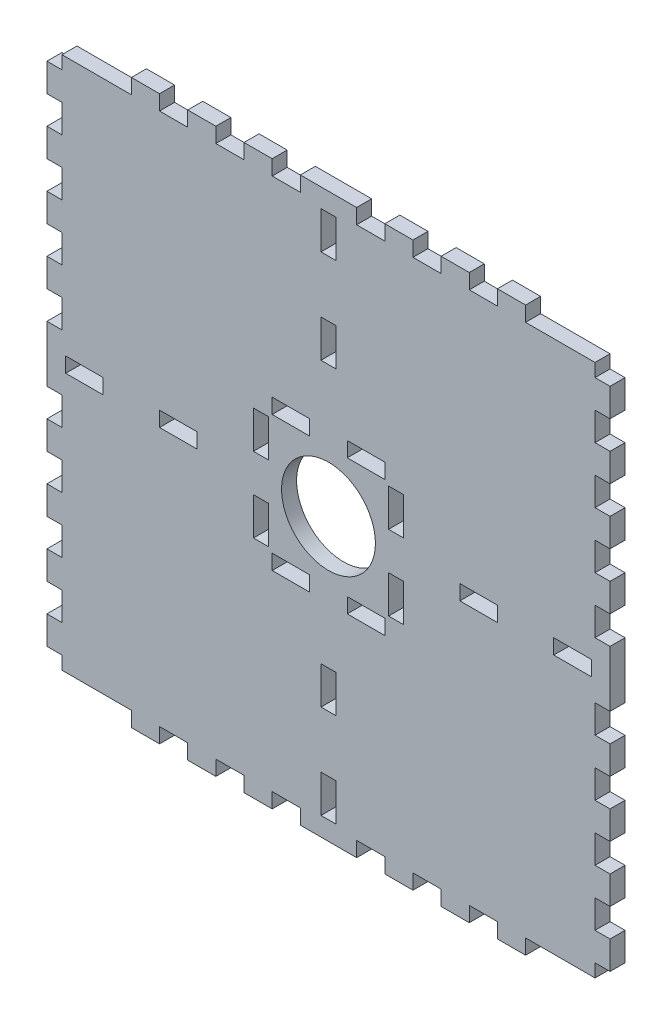
from build123d import *

# Parameters (mm, degrees)
ESQUISSE1_W                  = 300
ESQUISSE1_H                  = 300
BOSS_EXTRU_1_DEPTH           = 8
ESQUISSE3_W                  = 8
ESQUISSE3_H                  = 15
ENL_V_MAT_EXTRU_4_DEPTH      = 213.282830205
ESQUISSE4_R                  = 25
ENL_V_MAT_EXTRU_5_DEPTH      = 213.282830205
ESQUISSE5_W                  = 15
ESQUISSE5_H                  = 8
ESQUISSE5_W_2                = 37
ENL_V_MAT_EXTRU_6_DEPTH      = 213.282830205
ESQUISSE6_W                  = 20
ESQUISSE6_H                  = 8
ENL_V_MAT_EXTRU_7_DEPTH      = 213.282830205
R_P_TITION_CIRCULAIRE1_COUNT = 2
R_P_TITION_CIRCULAIRE1_ANGLE = 90
SYM_TRIE4_COPY_1_SKETCH_W    = 20
SYM_TRIE4_COPY_1_SKETCH_H    = 8
SYM_TRIE4_COPY_1_DEPTH       = 213.282830205
SYM_TRIE4_COPY_2_SKETCH_W    = 20
SYM_TRIE4_COPY_2_SKETCH_H    = 8
SYM_TRIE4_COPY_2_DEPTH       = 213.282830205
ESQUISSE7_W                  = 8
ESQUISSE7_H                  = 20
ENL_V_MAT_EXTRU_8_DEPTH      = 213.282830205
R_P_TITION_CIRCULAIRE2_COUNT = 2
R_P_TITION_CIRCULAIRE2_ANGLE = 90
SYM_TRIE6_COPY_1_SKETCH_W    = 8
SYM_TRIE6_COPY_1_SKETCH_H    = 20
SYM_TRIE6_COPY_1_DEPTH       = 213.282830205
SYM_TRIE6_COPY_2_SKETCH_W    = 8
SYM_TRIE6_COPY_2_SKETCH_H    = 20
SYM_TRIE6_COPY_2_DEPTH       = 213.282830205


with BuildPart() as part:
    # Esquisse1 → Boss.-Extru.1 (new body)
    with BuildSketch(Plane.XY):
        Rectangle(ESQUISSE1_W, ESQUISSE1_H)
    extrude(amount=BOSS_EXTRU_1_DEPTH)

    # Esquisse3 → Enlèv. mat.-Extru.4 (cut, through all)
    with BuildSketch(Plane.XY):
        with Locations((-146, -22.5)):
            Rectangle(ESQUISSE3_W, ESQUISSE3_H)
        with Locations((-146, -52.5)):
            Rectangle(ESQUISSE3_W, ESQUISSE3_H)
        with Locations((-146, -82.5)):
            Rectangle(ESQUISSE3_W, ESQUISSE3_H)
        with Locations((-146, -112.5)):
            Rectangle(ESQUISSE3_W, ESQUISSE3_H)
        with Locations((-146, -142.5)):
            Rectangle(ESQUISSE3_W, ESQUISSE3_H)
        with Locations((-146, 52.5)):
            Rectangle(ESQUISSE3_W, ESQUISSE3_H)
        with Locations((-146, 142.5)):
            Rectangle(ESQUISSE3_W, ESQUISSE3_H)
        with Locations((-146, 112.5)):
            Rectangle(ESQUISSE3_W, ESQUISSE3_H)
        with Locations((-146, 82.5)):
            Rectangle(ESQUISSE3_W, ESQUISSE3_H)
        with Locations((-146, 22.5)):
            Rectangle(ESQUISSE3_W, ESQUISSE3_H)
    enl_v_mat_extru_4 = extrude(amount=ENL_V_MAT_EXTRU_4_DEPTH, mode=Mode.SUBTRACT)

    # Symétrie1: Enlèv. mat.-Extru.4 across plane
    add(enl_v_mat_extru_4.mirror(Plane(origin=(0, 0, 0), x_dir=(0, 0, 1), z_dir=(1, 0, 0))), mode=Mode.SUBTRACT)

    # Esquisse4 → Enlèv. mat.-Extru.5 (cut, through all)
    with BuildSketch(Plane.XY):
        Circle(ESQUISSE4_R)
    extrude(amount=ENL_V_MAT_EXTRU_5_DEPTH, mode=Mode.SUBTRACT)

    # Esquisse5 → Enlèv. mat.-Extru.6 (cut, through all)
    with BuildSketch(Plane.XY):
        with Locations((22.5, 146)):
            Rectangle(ESQUISSE5_W, ESQUISSE5_H)
        with Locations((-22.5, 146)):
            Rectangle(ESQUISSE5_W, ESQUISSE5_H)
        with Locations((-52.5, 146)):
            Rectangle(ESQUISSE5_W, ESQUISSE5_H)
        with Locations((-82.5, 146)):
            Rectangle(ESQUISSE5_W, ESQUISSE5_H)
        with Locations((-123.5, 146)):
            Rectangle(ESQUISSE5_W_2, ESQUISSE5_H)
        with Locations((52.5, 146)):
            Rectangle(ESQUISSE5_W, ESQUISSE5_H)
        with Locations((82.5, 146)):
            Rectangle(ESQUISSE5_W, ESQUISSE5_H)
        with Locations((123.5, 146)):
            Rectangle(ESQUISSE5_W_2, ESQUISSE5_H)
    enl_v_mat_extru_6 = extrude(amount=ENL_V_MAT_EXTRU_6_DEPTH, mode=Mode.SUBTRACT)

    # Symétrie2: Enlèv. mat.-Extru.6 across plane
    add(enl_v_mat_extru_6.mirror(Plane.ZX), mode=Mode.SUBTRACT)

    # Esquisse6 → Enlèv. mat.-Extru.7 (cut, through all)
    with BuildSketch(Plane.XY):
        with Locations((-20, -36)):
            Rectangle(ESQUISSE6_W, ESQUISSE6_H)
        with Locations((20, -36)):
            Rectangle(ESQUISSE6_W, ESQUISSE6_H)
    enl_v_mat_extru_7 = extrude(amount=ENL_V_MAT_EXTRU_7_DEPTH, mode=Mode.SUBTRACT)

    # Symétrie3: Enlèv. mat.-Extru.7 across plane
    add(enl_v_mat_extru_7.mirror(Plane.ZX), mode=Mode.SUBTRACT)

    # Répétition circulaire1: Enlèv. mat.-Extru.7 ×2 about axis
    r_p_tition_circulaire1_axis = Axis((0, 0, 0), (0, 0, 1))
    for i in range(1, R_P_TITION_CIRCULAIRE1_COUNT):
        add(enl_v_mat_extru_7.rotate(r_p_tition_circulaire1_axis, i * R_P_TITION_CIRCULAIRE1_ANGLE / (R_P_TITION_CIRCULAIRE1_COUNT - 1)), mode=Mode.SUBTRACT)

    # Symétrie4 copy 1 sketch → Symétrie4 copy 1 (cut, through all)
    with BuildSketch(Plane(origin=(0, 0, 0), x_dir=(0, 1, 0), z_dir=(0, 0, 1))):
        with Locations((-20, 36)):
            Rectangle(SYM_TRIE4_COPY_1_SKETCH_W, SYM_TRIE4_COPY_1_SKETCH_H)
        with Locations((20, 36)):
            Rectangle(SYM_TRIE4_COPY_1_SKETCH_W, SYM_TRIE4_COPY_1_SKETCH_H)
    extrude(amount=SYM_TRIE4_COPY_1_DEPTH, mode=Mode.SUBTRACT)

    # Symétrie4 copy 2 sketch → Symétrie4 copy 2 (cut, through all)
    with BuildSketch(Plane(origin=(0, 0, 0), x_dir=(-1, 0, 0), z_dir=(0, 0, 1))):
        with Locations((-20, 36)):
            Rectangle(SYM_TRIE4_COPY_2_SKETCH_W, SYM_TRIE4_COPY_2_SKETCH_H)
        with Locations((20, 36)):
            Rectangle(SYM_TRIE4_COPY_2_SKETCH_W, SYM_TRIE4_COPY_2_SKETCH_H)
    extrude(amount=SYM_TRIE4_COPY_2_DEPTH, mode=Mode.SUBTRACT)

    # Esquisse7 → Enlèv. mat.-Extru.8 (cut, through all)
    with BuildSketch(Plane.XY):
        with Locations((0, -130)):
            Rectangle(ESQUISSE7_W, ESQUISSE7_H)
        with Locations((0, -80)):
            Rectangle(ESQUISSE7_W, ESQUISSE7_H)
    enl_v_mat_extru_8 = extrude(amount=ENL_V_MAT_EXTRU_8_DEPTH, mode=Mode.SUBTRACT)

    # Symétrie5: Enlèv. mat.-Extru.8 across plane
    add(enl_v_mat_extru_8.mirror(Plane.ZX), mode=Mode.SUBTRACT)

    # Répétition circulaire2: Enlèv. mat.-Extru.8 ×2 about axis
    r_p_tition_circulaire2_axis = Axis((0, 0, 0), (0, 0, 1))
    for i in range(1, R_P_TITION_CIRCULAIRE2_COUNT):
        add(enl_v_mat_extru_8.rotate(r_p_tition_circulaire2_axis, i * R_P_TITION_CIRCULAIRE2_ANGLE / (R_P_TITION_CIRCULAIRE2_COUNT - 1)), mode=Mode.SUBTRACT)

    # Symétrie6 copy 1 sketch → Symétrie6 copy 1 (cut, through all)
    with BuildSketch(Plane(origin=(0, 0, 0), x_dir=(0, 1, 0), z_dir=(0, 0, 1))):
        with Locations((0, 130)):
            Rectangle(SYM_TRIE6_COPY_1_SKETCH_W, SYM_TRIE6_COPY_1_SKETCH_H)
        with Locations((0, 80)):
            Rectangle(SYM_TRIE6_COPY_1_SKETCH_W, SYM_TRIE6_COPY_1_SKETCH_H)
    extrude(amount=SYM_TRIE6_COPY_1_DEPTH, mode=Mode.SUBTRACT)

    # Symétrie6 copy 2 sketch → Symétrie6 copy 2 (cut, through all)
    with BuildSketch(Plane(origin=(0, 0, 0), x_dir=(-1, 0, 0), z_dir=(0, 0, 1))):
        with Locations((0, 130)):
            Rectangle(SYM_TRIE6_COPY_2_SKETCH_W, SYM_TRIE6_COPY_2_SKETCH_H)
        with Locations((0, 80)):
            Rectangle(SYM_TRIE6_COPY_2_SKETCH_W, SYM_TRIE6_COPY_2_SKETCH_H)
    extrude(amount=SYM_TRIE6_COPY_2_DEPTH, mode=Mode.SUBTRACT)


solid = part.part
